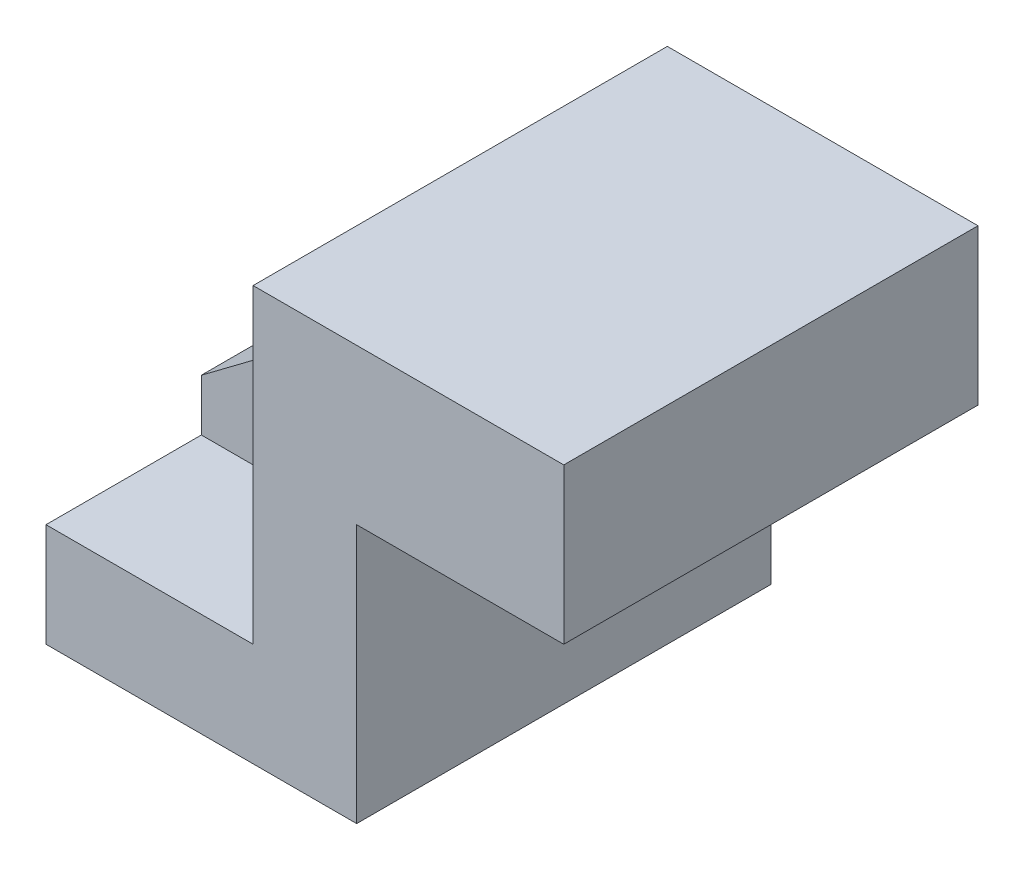
from build123d import *

# Parameters (mm, degrees)
BOSS_EXTRUDE1_DEPTH = 40
BOSS_EXTRUDE2_DEPTH = 10


with BuildPart() as part:
    # Sketch1 → Boss-Extrude1 (new, symmetric)
    with BuildSketch(Plane.XY):
        Polygon((0, 20), (0, 0), (60, 0), (60, 50), (100, 50), (100, 80), (40, 80), (40, 60), (40, 20), align=None)
    extrude(amount=BOSS_EXTRUDE1_DEPTH, both=True)

    # Sketch1<3> → Boss-Extrude2 (add, symmetric)
    with BuildSketch(Plane.XY):
        Polygon((0, 30), (0, 20), (40, 20), (40, 60), align=None)
    extrude(amount=BOSS_EXTRUDE2_DEPTH, both=True)


solid = part.part
